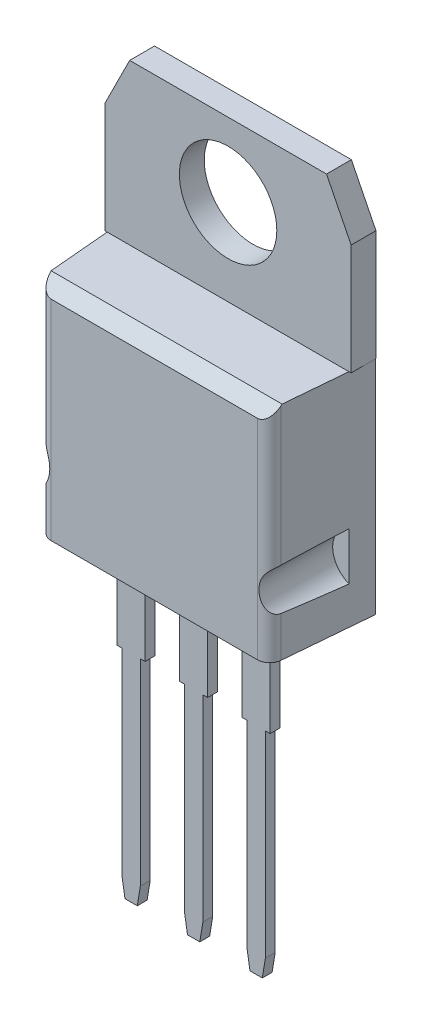
from build123d import *

# Parameters (mm, degrees)
SKETCH2_W                = 10
SKETCH2_H                = 9
BOSS_EXTRUDE1_DEPTH      = 4
CHAMFER1_SIZE            = 0.5
CUT_EXTRUDE1_DEPTH       = 3
BOSS_EXTRUDE2_DEPTH      = 0.4
LPATTERN1_COUNT          = 2
LPATTERN1_PITCH          = 2.54
LPATTERN2_COUNT          = 2
LPATTERN2_PITCH          = 2.54
DRAFT2_ANGLE             = -5
BOSS_EXTRUDE3_DEPTH      = 0.01
BOSS_EXTRUDE3_DEPTH_BACK = 1
SKETCH8_R                = 1.98
FILLET1_R                = 0.5


with BuildPart() as part:
    # Sketch2 → Boss-Extrude1 (new body)
    with BuildSketch(Plane.XY):
        Rectangle(SKETCH2_W, SKETCH2_H)
    extrude(amount=BOSS_EXTRUDE1_DEPTH)

    # Chamfer1
    chamfer1_edges = [part.edges().sort_by_distance(p)[0] for p in [
        (0, 4.5, 4),
    ]]
    chamfer(chamfer1_edges, length=CHAMFER1_SIZE)

    # Sketch6 → Cut-Extrude1 (cut)
    with BuildSketch(Plane.XY.offset(4)):
        with BuildLine():
            Line((5, -1), (5, -3))
            ThreePointArc((5, -3), (4.25, -2), (5, -1))
        make_face()
    cut_extrude1 = extrude(amount=-CUT_EXTRUDE1_DEPTH, mode=Mode.SUBTRACT)

    # Mirror1: Cut-Extrude1 across plane
    add(cut_extrude1.mirror(Plane(origin=(0, 0, 0), x_dir=(0, 0, 1), z_dir=(1, 0, 0))), mode=Mode.SUBTRACT)

    # Sketch7 → Boss-Extrude2 (add)
    with BuildSketch(Plane.XY.offset(2)):
        Polygon((-0.57, -4.5), (-0.57, -8.44), (-0.375, -8.44), (-0.375, -16.44), (-0.25, -17.2), (0.25, -17.2), (0.375, -16.44), (0.375, -8.44), (0.57, -8.44), (0.57, -4.5), align=None)
    boss_extrude2 = extrude(amount=BOSS_EXTRUDE2_DEPTH)

    # LPattern1: Boss-Extrude2 ×2
    with Locations(*[(-i * LPATTERN1_PITCH, 0, 0) for i in range(1, LPATTERN1_COUNT)]):
        add(boss_extrude2)

    # LPattern2: Boss-Extrude2 ×2
    with Locations(*[(i * LPATTERN2_PITCH, 0, 0) for i in range(1, LPATTERN2_COUNT)]):
        add(boss_extrude2)

    # Draft2
    draft2_faces = [part.faces().sort_by_distance(p)[0] for p in [
        (5, 0.383542538, 1.891910739),
        (-5, 0.383542538, 1.891910739),
    ]]
    draft(draft2_faces, Plane(origin=(0, 0, 0), x_dir=(-1, 0, 0), z_dir=(0, 0, -1)), DRAFT2_ANGLE)

    # Sketch8 → Boss-Extrude3 (add, two sides: drawn at the far end of the back side and taken through both)
    with BuildSketch(Plane(origin=(0, 0, 0), x_dir=(-1, 0, 0), z_dir=(0, 0, -1)).offset(-BOSS_EXTRUDE3_DEPTH_BACK)):
        Polygon((-5, 9), (-4, 11), (4, 11), (5, 9), (5, 4.5), (-5, 4.5), align=None)
        with Locations(Location((0, 8, 0), (0, 0, 180))):
            Circle(SKETCH8_R, mode=Mode.SUBTRACT)
    extrude(amount=BOSS_EXTRUDE3_DEPTH + BOSS_EXTRUDE3_DEPTH_BACK)

    # Fillet1
    fillet1_edges = [part.edges().sort_by_distance(p)[0] for p in [
        (-4.650045346, 1.410302183, 4),
        (4.650045346, 1.410302183, 4),
    ]]
    fillet(fillet1_edges, radius=FILLET1_R)


solid = part.part
